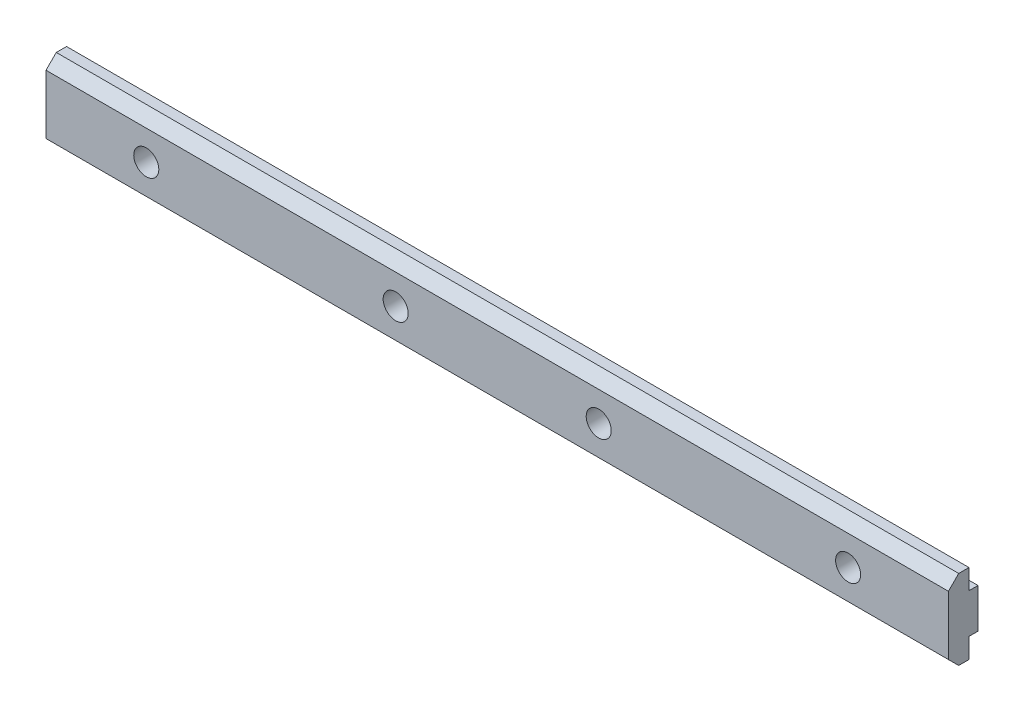
from build123d import *

# Parameters (mm, degrees)
EXTRUDE_1_DEPTH        = 90
HOLE_WIZARD_M6_1_D     = 5
HOLE_WIZARD_M6_1_DEPTH = 28
HOLE_WIZARD_M6_1_TIP   = 1.502151548


with BuildPart() as part:
    # 草图1 → 凸台-拉伸1 (new, symmetric)
    with BuildSketch(Plane(origin=(0, 0, 0), x_dir=(0, 0, -1), z_dir=(1, 0, 0))):
        Polygon((-4.1, 13.85), (-4.1, 2.05), (-2.05, 0), (0, 0), (0, 4), (1.8, 4), (1.8, 11.9), (0, 11.9), (0, 15.9), (-2.05, 15.9), align=None)
    extrude(amount=EXTRUDE_1_DEPTH, both=True)

    # M6 螺纹孔1
    with Locations(Plane(origin=(70, 7.95, -1.8), x_dir=(-1, 0, 0), z_dir=(0, 0, -1))):
        with Locations((0, 0), (49.75, 0), (90.25, 0), (140, 0)):
            Hole(HOLE_WIZARD_M6_1_D / 2, depth=HOLE_WIZARD_M6_1_DEPTH)
            with Locations((0, 0, -(HOLE_WIZARD_M6_1_DEPTH + HOLE_WIZARD_M6_1_TIP / 2))):  # 118° drill point
                Cone(0, HOLE_WIZARD_M6_1_D / 2, HOLE_WIZARD_M6_1_TIP, mode=Mode.SUBTRACT)


solid = part.part
